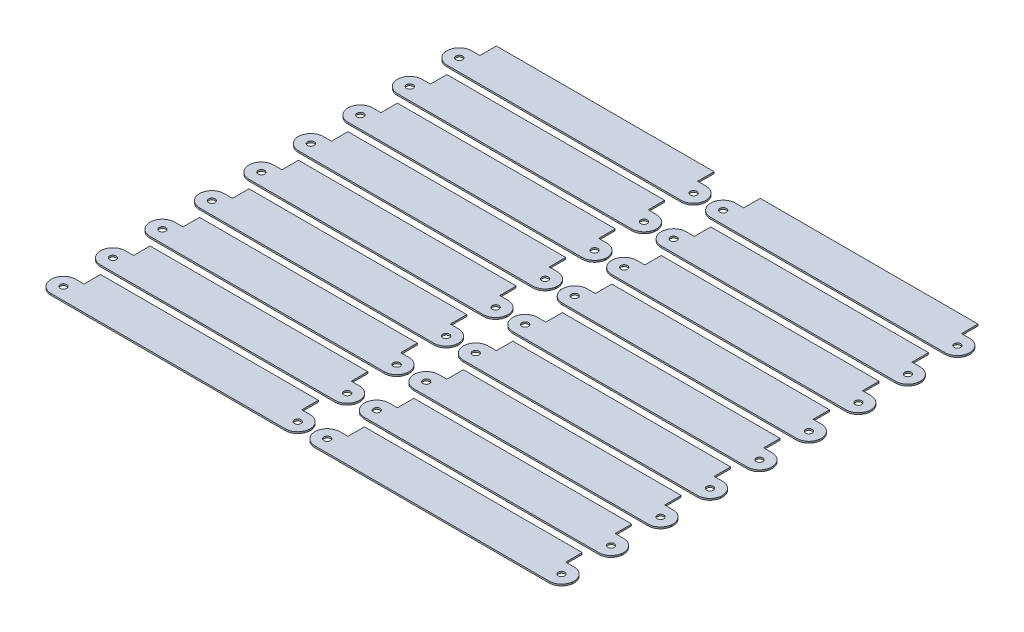
from build123d import *

# Parameters (mm, degrees)
SKETCH1_R           = 2
BOSS_EXTRUDE1_DEPTH = 1
LPATTERN1_COUNT     = 9
LPATTERN1_PITCH     = 30
LPATTERN1_2_COUNT   = 2
LPATTERN1_2_PITCH   = 160


with BuildPart() as part:
    # Sketch1 → Boss-Extrude1 (new body)
    with BuildSketch(Plane(origin=(0, 0, 0), x_dir=(1, 0, 0), z_dir=(0, 1, 0))):
        with BuildLine():
            Line((0, 7.5), (5, 7.5))
            Line((5, 7.5), (5, 17.5))
            Line((5, 17.5), (137.06, 17.5))
            Line((137.06, 17.5), (137.06, 7.5))
            Line((137.06, 7.5), (142.06, 7.5))
            ThreePointArc((142.06, 7.5), (146.997104415, 5.645794895), (149.493034374, 1))
            Line((149.493034374, 1), (149.56, 1))
            Line((149.56, 1), (149.56, -1))
            Line((149.56, -1), (149.493034374, -1))
            ThreePointArc((149.493034374, -1), (146.997104415, -5.645794895), (142.06, -7.5))
            Line((142.06, -7.5), (0, -7.5))
            ThreePointArc((0, -7.5), (-4.937104415, -5.645794895), (-7.433034374, -1))
            Line((-7.433034374, -1), (-7.5, -1))
            Line((-7.5, -1), (-7.5, 1))
            Line((-7.5, 1), (-7.433034374, 1))
            ThreePointArc((-7.433034374, 1), (-4.937104415, 5.645794895), (0, 7.5))
        make_face()
        with Locations(Location((0, 0, 0), (0, 0, 270))):
            Circle(SKETCH1_R, mode=Mode.SUBTRACT)
        with Locations(Location((142.06, 0, 0), (0, 0, 270))):
            Circle(SKETCH1_R, mode=Mode.SUBTRACT)
    extrude(amount=BOSS_EXTRUDE1_DEPTH)


with BuildPart() as lpattern1_1:
    # LPattern1: pattern copy
    add(part.part.moved(Location(Vector(0, 0, -1) * (1 * LPATTERN1_PITCH))))


with BuildPart() as lpattern1_2:
    # LPattern1: pattern copy
    add(part.part.moved(Location(Vector(0, 0, -1) * (2 * LPATTERN1_PITCH))))


with BuildPart() as lpattern1_3:
    # LPattern1: pattern copy
    add(part.part.moved(Location(Vector(0, 0, -1) * (3 * LPATTERN1_PITCH))))


with BuildPart() as lpattern1_4:
    # LPattern1: pattern copy
    add(part.part.moved(Location(Vector(0, 0, -1) * (4 * LPATTERN1_PITCH))))


with BuildPart() as lpattern1_5:
    # LPattern1: pattern copy
    add(part.part.moved(Location(Vector(0, 0, -1) * (5 * LPATTERN1_PITCH))))


with BuildPart() as lpattern1_6:
    # LPattern1: pattern copy
    add(part.part.moved(Location(Vector(0, 0, -1) * (6 * LPATTERN1_PITCH))))


with BuildPart() as lpattern1_7:
    # LPattern1: pattern copy
    add(part.part.moved(Location(Vector(0, 0, -1) * (7 * LPATTERN1_PITCH))))


with BuildPart() as lpattern1_8:
    # LPattern1: pattern copy
    add(part.part.moved(Location(Vector(0, 0, -1) * (8 * LPATTERN1_PITCH))))


with BuildPart() as lpattern1_2_1:
    # LPattern1 2: pattern copy
    add(part.part.moved(Location(Vector(1, 0, 0) * (1 * LPATTERN1_2_PITCH))))


with BuildPart() as lpattern1_2_2:
    # LPattern1 2: pattern copy
    add(lpattern1_1.part.moved(Location(Vector(1, 0, 0) * (1 * LPATTERN1_2_PITCH))))


with BuildPart() as lpattern1_2_3:
    # LPattern1 2: pattern copy
    add(lpattern1_2.part.moved(Location(Vector(1, 0, 0) * (1 * LPATTERN1_2_PITCH))))


with BuildPart() as lpattern1_2_4:
    # LPattern1 2: pattern copy
    add(lpattern1_3.part.moved(Location(Vector(1, 0, 0) * (1 * LPATTERN1_2_PITCH))))


with BuildPart() as lpattern1_2_5:
    # LPattern1 2: pattern copy
    add(lpattern1_4.part.moved(Location(Vector(1, 0, 0) * (1 * LPATTERN1_2_PITCH))))


with BuildPart() as lpattern1_2_6:
    # LPattern1 2: pattern copy
    add(lpattern1_5.part.moved(Location(Vector(1, 0, 0) * (1 * LPATTERN1_2_PITCH))))


with BuildPart() as lpattern1_2_7:
    # LPattern1 2: pattern copy
    add(lpattern1_6.part.moved(Location(Vector(1, 0, 0) * (1 * LPATTERN1_2_PITCH))))


with BuildPart() as lpattern1_2_8:
    # LPattern1 2: pattern copy
    add(lpattern1_7.part.moved(Location(Vector(1, 0, 0) * (1 * LPATTERN1_2_PITCH))))


with BuildPart() as lpattern1_2_9:
    # LPattern1 2: pattern copy
    add(lpattern1_8.part.moved(Location(Vector(1, 0, 0) * (1 * LPATTERN1_2_PITCH))))


solid = Compound([part.part, lpattern1_1.part, lpattern1_2.part, lpattern1_3.part, lpattern1_4.part, lpattern1_5.part, lpattern1_6.part, lpattern1_7.part, lpattern1_8.part, lpattern1_2_1.part, lpattern1_2_2.part, lpattern1_2_3.part, lpattern1_2_4.part, lpattern1_2_5.part, lpattern1_2_6.part, lpattern1_2_7.part, lpattern1_2_8.part, lpattern1_2_9.part])
